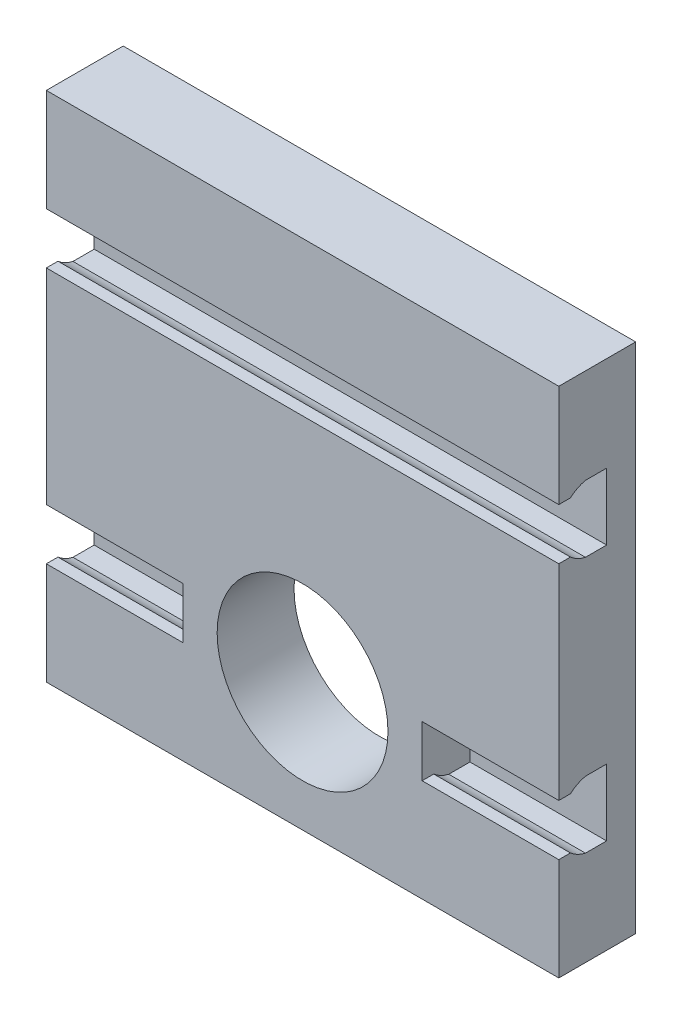
from build123d import *

# Parameters (mm, degrees)
SKETCH_2_W          = 30
SKETCH_2_H          = 30
SKETCH_2_R          = 5
EXTRUDE_1_DEPTH     = 4.5
CUT_EXTRUDE_1_DEPTH = 35.5325933
CUT_EXTRUDE_2_DEPTH = 8


with BuildPart() as part:
    # 草图2 → 凸台-拉伸1 (new body)
    with BuildSketch(Plane.XY):
        with Locations((0, 1.5)):
            Rectangle(SKETCH_2_W, SKETCH_2_H)
        with Locations((0, -6)):
            Circle(SKETCH_2_R, mode=Mode.SUBTRACT)
    extrude(amount=EXTRUDE_1_DEPTH)

    # 草图4 → 切除-拉伸1 (cut, through all)
    with BuildSketch(Plane(origin=(15, 0, 0), x_dir=(0, 0, -1), z_dir=(1, 0, 0))):
        with BuildLine():
            Line((-4.5, 7.5), (-3.82, 7.5))
            ThreePointArc((-3.82, 7.5), (-3.408962817, 7.219957697), (-2.941534065, 7.05))
            Line((-2.941534065, 7.05), (-1.7, 7.05))
            Line((-1.7, 7.05), (-1.7, 10.95))
            Line((-1.7, 10.95), (-2.941534065, 10.95))
            ThreePointArc((-2.941534065, 10.95), (-3.408962817, 10.780042303), (-3.82, 10.5))
            Line((-3.82, 10.5), (-4.5, 10.5))
            Line((-4.5, 10.5), (-4.5, 7.5))
        make_face()
    extrude(amount=-CUT_EXTRUDE_1_DEPTH, mode=Mode.SUBTRACT)

    # 草图5 → 切除-拉伸2 (cut)
    with BuildSketch(Plane(origin=(15, 0, 0), x_dir=(0, 0, -1), z_dir=(1, 0, 0))):
        with BuildLine():
            Line((-1.7, -4.05), (-1.7, -7.95))
            Line((-1.7, -7.95), (-2.941534065, -7.95))
            ThreePointArc((-2.941534065, -7.95), (-3.408962817, -7.780042303), (-3.82, -7.5))
            Line((-3.82, -7.5), (-4.5, -7.5))
            Line((-4.5, -7.5), (-4.5, -4.5))
            Line((-4.5, -4.5), (-3.82, -4.5))
            ThreePointArc((-3.82, -4.5), (-3.408962817, -4.219957697), (-2.941534065, -4.05))
            Line((-2.941534065, -4.05), (-1.7, -4.05))
        make_face()
    cut_extrude_2 = extrude(amount=-CUT_EXTRUDE_2_DEPTH, mode=Mode.SUBTRACT)

    # 镜向1: 切除-拉伸2 across plane
    add(cut_extrude_2.mirror(Plane(origin=(0, 0, 0), x_dir=(0, 0, 1), z_dir=(1, 0, 0))), mode=Mode.SUBTRACT)


solid = part.part
